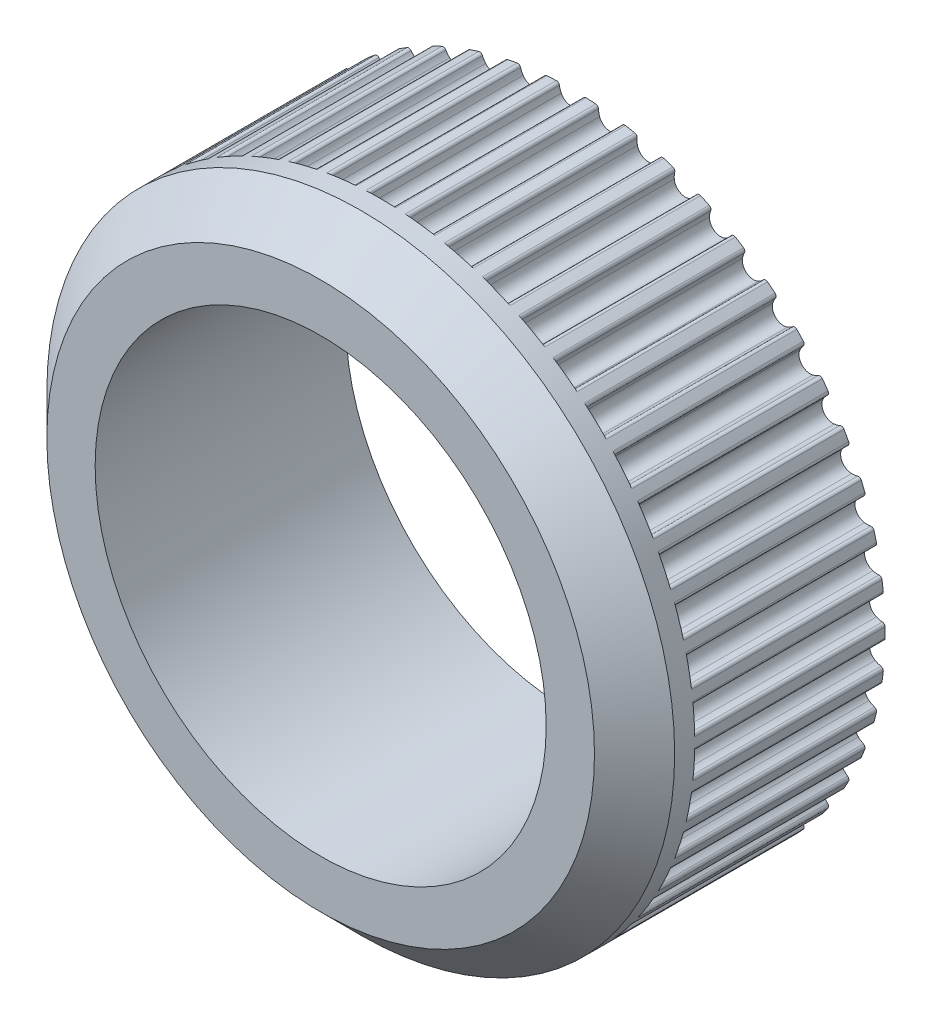
from build123d import *
from build123d.topology import SkipClean

# Parameters (mm, degrees)
CUT_EXTRUDE1_START  = -0.6963
CUT_EXTRUDE1_DEPTH  = 10
CIRPATTERN1_COUNT   = 50
BOSS_EXTRUDE1_START = 3
SKETCH4_R           = 15.659
SKETCH4_R_2         = 11.25
BOSS_EXTRUDE1_DEPTH = 3
CHAMFER1_SIZE       = 2


with BuildPart() as part:
    # Sketch2 → Revolve1 (revolve)
    with BuildSketch(Plane(origin=(0, 0, 0), x_dir=(0, 0, -1), z_dir=(1, 0, 0)), mode=Mode.PRIVATE) as revolve1_sk:
        Polygon((-0.3687, 11.25), (9.1313, 11.25), (9.1313, 18.669), (8.5988, 18.669), (8.0663, 17.164), (8.0663, 15.659), (0.6963, 15.659), (0.6963, 17.164), (0.1638, 18.669), (-0.3687, 18.669), align=None)
    revolve(revolve1_sk.sketch.rotate(Axis((0, 0, 9.1313), (0, 0, -1)), 90), axis=Axis((0, 0, 9.1313), (0, 0, -1)))

    # Sketch3 → Cut-Extrude1 (cut, symmetric)
    with BuildSketch(Plane.XY.offset(CUT_EXTRUDE1_START)):
        with BuildLine():
            Line((2.360388574, 18.669), (-2.360388574, 18.669))
            Line((-2.360388574, 18.669), (-1.964186526, 15.535322729))
            ThreePointArc((-1.964186526, 15.535322729), (-1.355560393, 15.600215929), (-0.744863159, 15.641274241))
            ThreePointArc((-0.744863159, 15.641274241), (-0.642421679, 15.607274541), (-0.589328695, 15.513299164))
            ThreePointArc((-0.589328695, 15.513299164), (-0.555363226, 15.363566239), (-0.498876404, 15.220797753))
            ThreePointArc((-0.498876404, 15.220797753), (0, 14.909), (0.498876404, 15.220797753))
            ThreePointArc((0.498876404, 15.220797753), (0.555363226, 15.363566239), (0.589328695, 15.513299164))
            ThreePointArc((0.589328695, 15.513299164), (0.642421679, 15.607274541), (0.744863159, 15.641274241))
            ThreePointArc((0.744863159, 15.641274241), (1.355560393, 15.600215929), (1.964186526, 15.535322729))
            Line((1.964186526, 15.535322729), (2.360388574, 18.669))
        make_face()
    cut_extrude1 = extrude(amount=CUT_EXTRUDE1_DEPTH, both=True, mode=Mode.SUBTRACT)

    # CirPattern1: Cut-Extrude1 ×50 about axis
    with SkipClean():  # the faces are left unmerged after this step: merging them gives an invalid solid
        cirpattern1_axis = Axis((0, 0, 0), (0, 0, 1))
        for i in range(1, CIRPATTERN1_COUNT):
            add(cut_extrude1.rotate(cirpattern1_axis, i * 360 / CIRPATTERN1_COUNT), mode=Mode.SUBTRACT)

    # Sketch4 → Boss-Extrude1 (add)
    with BuildSketch(Plane.XY.offset(0.3687).offset(BOSS_EXTRUDE1_START)):
        Circle(SKETCH4_R)
        Circle(SKETCH4_R_2, mode=Mode.SUBTRACT)
    extrude(amount=-BOSS_EXTRUDE1_DEPTH)

    # Chamfer1
    chamfer1_edges = [part.edges().sort_by_distance(p)[0] for p in [
        (-15.659, 0, 3.3687),
    ]]
    chamfer(chamfer1_edges, length=CHAMFER1_SIZE)


solid = part.part
